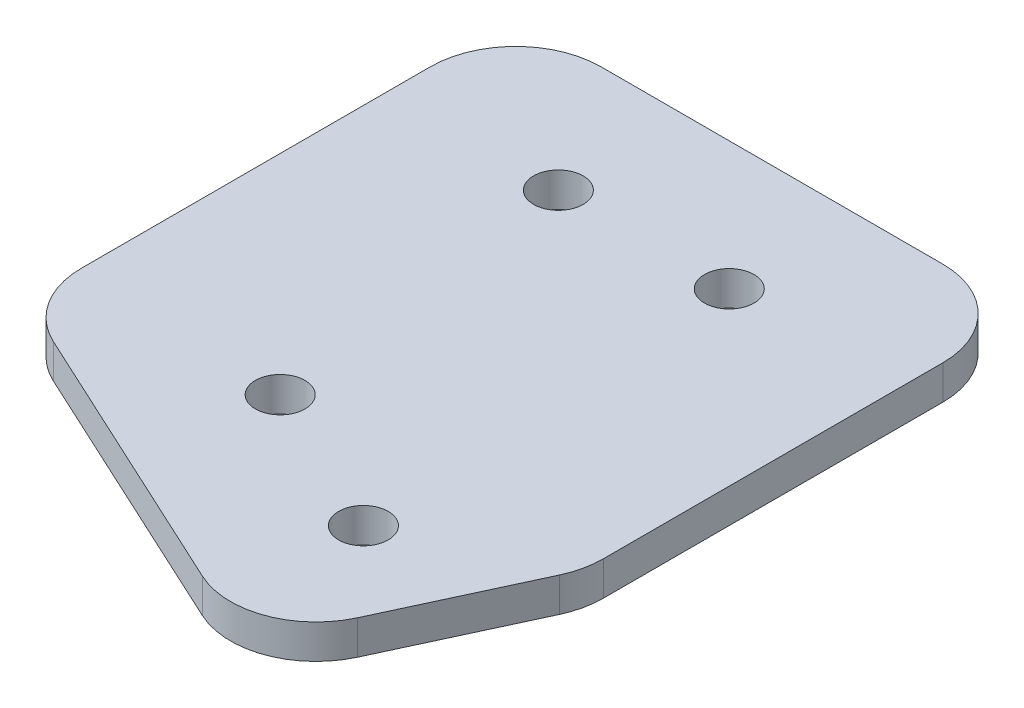
from build123d import *

# Parameters (mm, degrees)
SKETCH_1_R      = 1.45
EXTRUDE_1_DEPTH = 2
FILLET_1_R      = 5


with BuildPart() as part:
    # 草图1 → 凸台-拉伸1 (new body)
    with BuildSketch(Plane(origin=(0, 0, 0), x_dir=(1, 0, 0), z_dir=(0, 1, 0))):
        Polygon((-230, 126.877091055), (-230, 98.266220035), (-206.304299333, 87.290817382), (-200, 100.901688402), (-200, 126.877091055), align=None)
        with Locations(Location((-217.77393632, 100.868789323, 0), (0, 0, 270))):
            Circle(SKETCH_1_R, mode=Mode.SUBTRACT)
        with Locations(Location((-208.700022307, 96.665923102, 0), (0, 0, 270))):
            Circle(SKETCH_1_R, mode=Mode.SUBTRACT)
        with Locations(Location((-220, 119.377091055, 0), (0, 0, 270))):
            Circle(SKETCH_1_R, mode=Mode.SUBTRACT)
        with Locations(Location((-210, 119.377091055, 0), (0, 0, 270))):
            Circle(SKETCH_1_R, mode=Mode.SUBTRACT)
    extrude(amount=EXTRUDE_1_DEPTH)

    # 圆角1
    fillet_1_edges = [part.edges().sort_by_distance(p)[0] for p in [
        (-200, 1, -126.877091055),
        (-200, 1, -100.901688402),
        (-206.304299333, 1, -87.290817382),
        (-230, 1, -98.266220035),
        (-230, 1, -126.877091055),
    ]]
    fillet(fillet_1_edges, radius=FILLET_1_R)


solid = part.part
